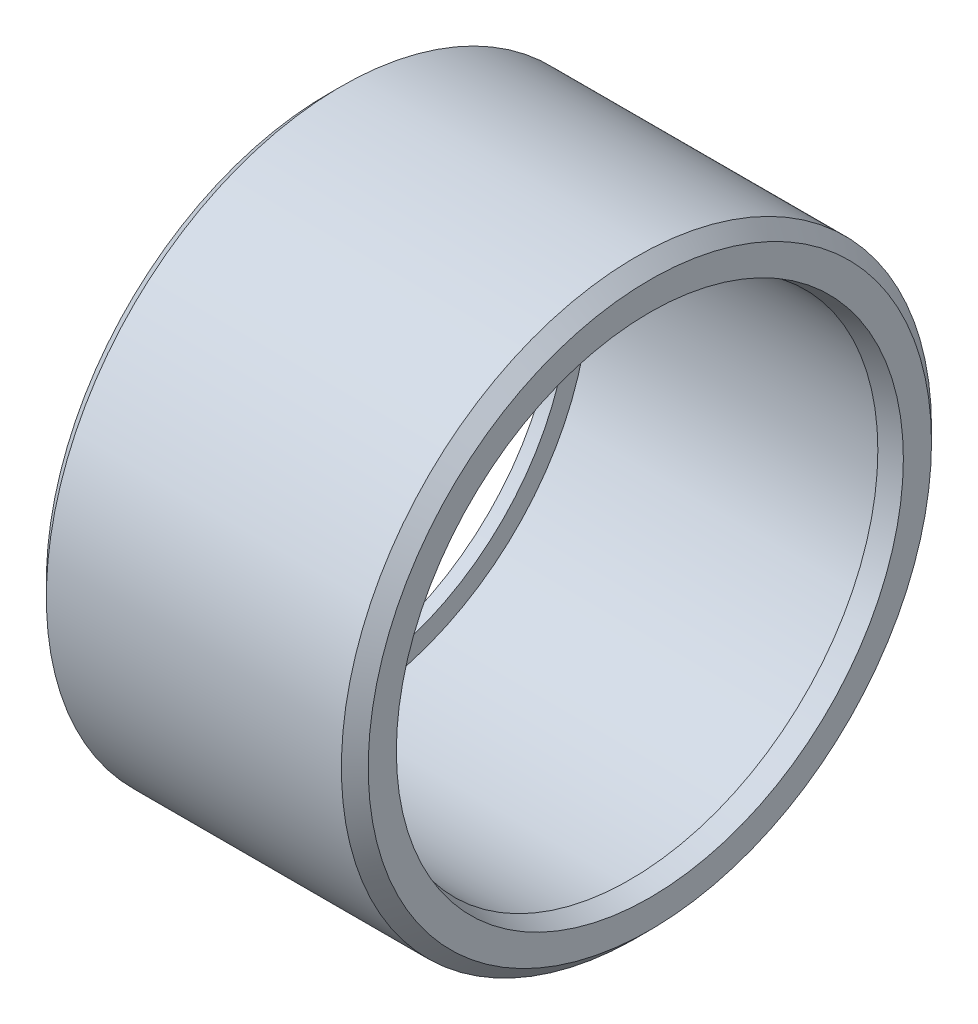
from build123d import *


with BuildPart() as part:
    # Esquisse1 → Révolution1 (revolve)
    with BuildSketch(Plane.XY, mode=Mode.PRIVATE) as r_volution1_sk:
        Polygon((-22, 17), (-22, 21), (-21, 22), (1, 22), (2, 21), (2, 18.901923789), (0.5, 18.5), (-21, 18.5), (-21, 17), align=None)
    revolve(r_volution1_sk.sketch.rotate(Axis((0, 0, 0), (-1, 0, 0)), 90), axis=Axis((0, 0, 0), (-1, 0, 0)))


solid = part.part
